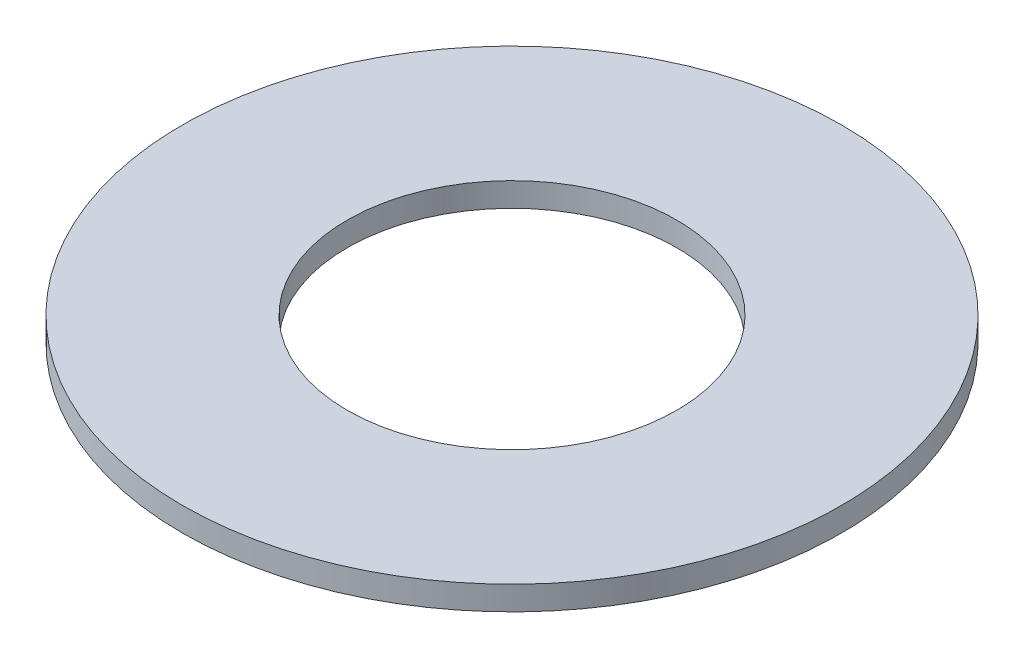
from build123d import *

# Parameters (mm, degrees)
SKETCH1_R           = 11
SKETCH1_R_2         = 5.5
BOSS_EXTRUDE1_DEPTH = 0.8


with BuildPart() as part:
    # Sketch1 → Boss-Extrude1 (new body)
    with BuildSketch(Plane(origin=(0, 0, 0), x_dir=(1, 0, 0), z_dir=(0, 1, 0))):
        with Locations(Location((0, 0, 0), (0, 0, 270))):
            Circle(SKETCH1_R)
        with Locations(Location((0, 0, 0), (0, 0, 270))):
            Circle(SKETCH1_R_2, mode=Mode.SUBTRACT)
    extrude(amount=BOSS_EXTRUDE1_DEPTH)


solid = part.part
